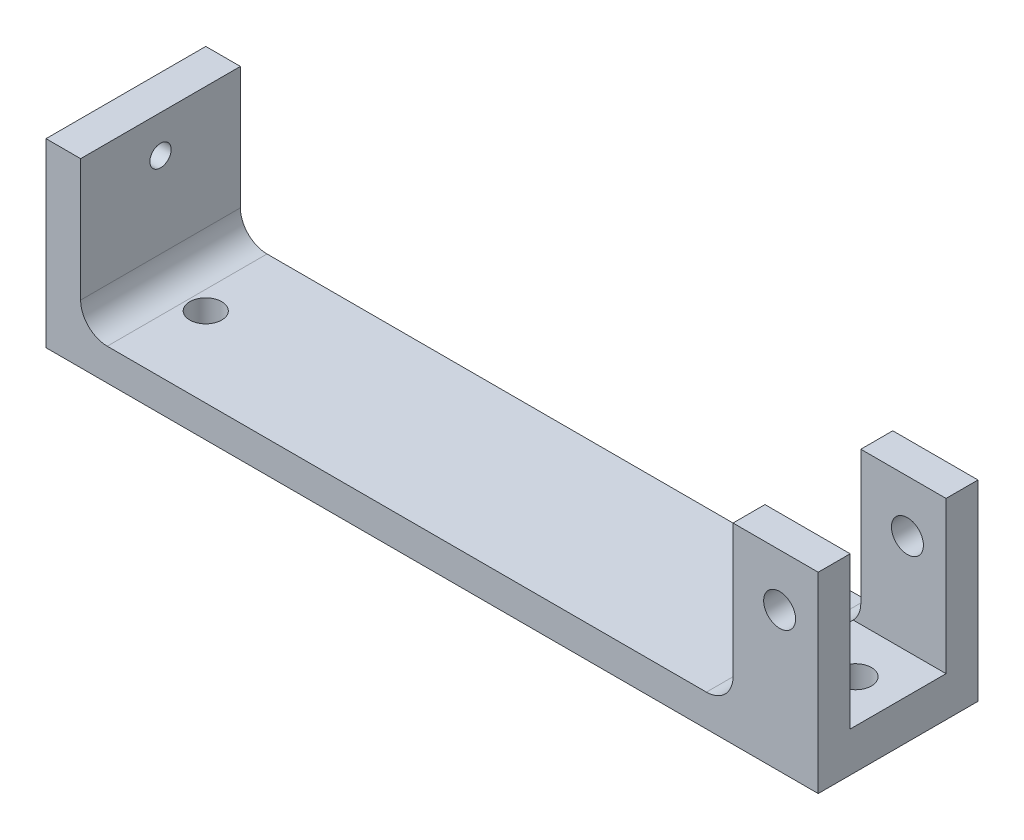
from build123d import *

# Parameters (mm, degrees)
BOSS_EXTRUDE1_DEPTH      = 15
BOSS_EXTRUDE1_DEPTH_BACK = 15
SKETCH2_R                = 3
CUT_EXTRUDE1_DEPTH       = 83.324054808
FILLET1_R                = 5
CUT_EXTRUDE2_START       = -28.5
SKETCH3_W                = 5
SKETCH3_H                = 18
CUT_EXTRUDE2_DEPTH       = 28.5
CUT_EXTRUDE3_DEPTH       = 83.324054808
CUT_EXTRUDE3_DEPTH_BACK  = 83.324054808
SKETCH4_R                = 3
SKETCH5_R                = 2
CUT_EXTRUDE4_DEPTH       = 83.324054808


with BuildPart() as part:
    # Sketch1 → Boss-Extrude1 (new, two sides: drawn at the far end of the back side and taken through both)
    with BuildSketch(Plane.XY.offset(-BOSS_EXTRUDE1_DEPTH_BACK)):
        Polygon((-72.5, 34), (-72.5, 0), (72.5, 0), (72.5, 36), (56.5, 36), (56.5, 6), (-66, 6), (-66, 34), align=None)
    extrude(amount=BOSS_EXTRUDE1_DEPTH + BOSS_EXTRUDE1_DEPTH_BACK)

    # Sketch2 → Cut-Extrude1 (cut, through all)
    with BuildSketch(Plane(origin=(0, 0, 0), x_dir=(1, 0, 0), z_dir=(0, 1, 0))):
        with Locations(Location((-57.5, 0, 0), (0, 0, 180))):
            Circle(SKETCH2_R)
        with Locations(Location((64.5, 0, 0), (0, 0, 270))):
            Circle(SKETCH2_R)
    extrude(amount=CUT_EXTRUDE1_DEPTH, mode=Mode.SUBTRACT)

    # Fillet1
    fillet1_edges = [part.edges().sort_by_distance(p)[0] for p in [
        (-66, 6, 0),
        (56.5, 6, 0),
    ]]
    fillet(fillet1_edges, radius=FILLET1_R)

    # Sketch3 → Cut-Extrude2 (cut)
    with BuildSketch(Plane(origin=(0, 36, 0), x_dir=(1, 0, 0), z_dir=(0, 1, 0)).offset(CUT_EXTRUDE2_START)):
        with BuildLine():
            Line((72.5, 9), (56.5, 9))
            Line((56.5, 9), (56.5, -9))
            Line((56.5, -9), (62.506908484, -2.242227956))
            ThreePointArc((62.506908484, -2.242227956), (62.257772044, 1.993091516), (66.493091516, 2.242227956))
            Line((66.493091516, 2.242227956), (72.5, 9))
        make_face()
        with Locations((54, 0)):
            Rectangle(SKETCH3_W, SKETCH3_H)
        with BuildLine():
            Line((72.5, -9), (72.5, 9))
            Line((72.5, 9), (66.493091516, 2.242227956))
            ThreePointArc((66.493091516, 2.242227956), (67.236720167, 1.228968155), (67.5, 0))
            ThreePointArc((67.5, 0), (65.728968155, -2.736720167), (62.506908484, -2.242227956))
            Line((62.506908484, -2.242227956), (56.5, -9))
            Line((56.5, -9), (72.5, -9))
        make_face()
    extrude(amount=CUT_EXTRUDE2_DEPTH, mode=Mode.SUBTRACT)

    # Sketch4 → Cut-Extrude3 (cut, two sides: drawn at the far end of the back side and taken through both)
    with BuildSketch(Plane.XY.offset(-CUT_EXTRUDE3_DEPTH_BACK)):
        with Locations((65.25, 26.25)):
            Circle(SKETCH4_R)
    extrude(amount=CUT_EXTRUDE3_DEPTH + CUT_EXTRUDE3_DEPTH_BACK, mode=Mode.SUBTRACT)

    # Sketch5 → Cut-Extrude4 (cut, through all)
    with BuildSketch(Plane(origin=(0, 0, 0), x_dir=(0, 0, -1), z_dir=(1, 0, 0))):
        with Locations((0, 27)):
            Circle(SKETCH5_R)
    extrude(amount=-CUT_EXTRUDE4_DEPTH, mode=Mode.SUBTRACT)


solid = part.part
